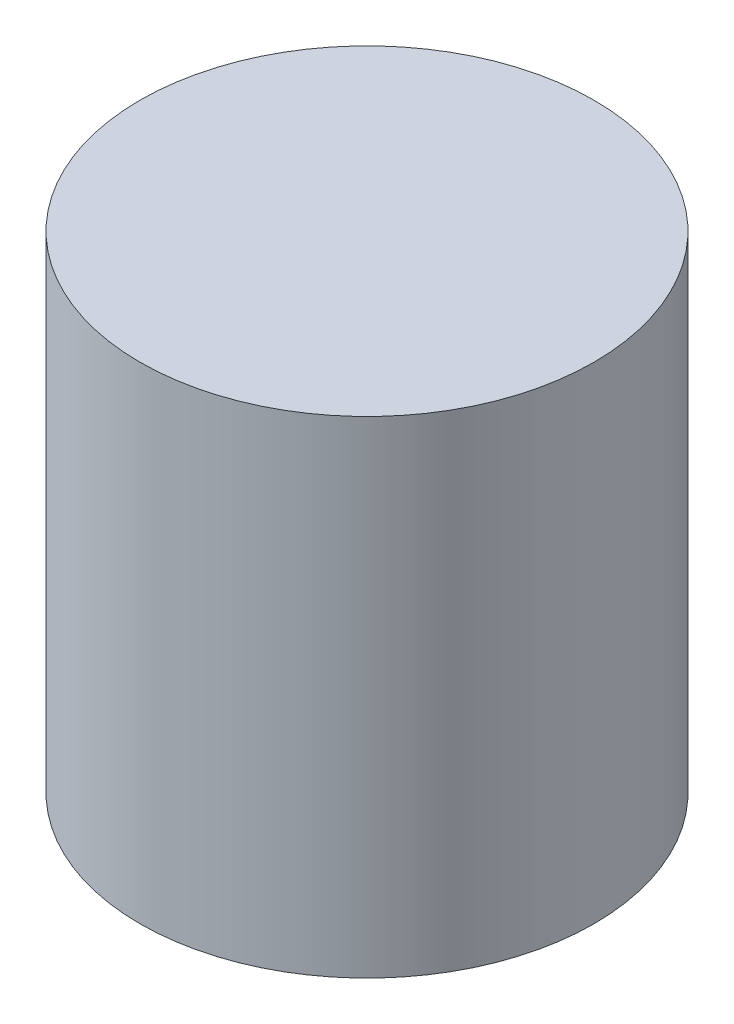
from build123d import *

# Parameters (mm, degrees)
SKETCH1_R           = 14
BOSS_EXTRUDE1_DEPTH = 30


with BuildPart() as part:
    # Sketch1 → Boss-Extrude1 (new body)
    with BuildSketch(Plane(origin=(0, 0, 0), x_dir=(1, 0, 0), z_dir=(0, 1, 0))):
        with Locations(Location((0, 0, 0), (0, 0, 270))):
            Circle(SKETCH1_R)
    extrude(amount=BOSS_EXTRUDE1_DEPTH)


solid = part.part
